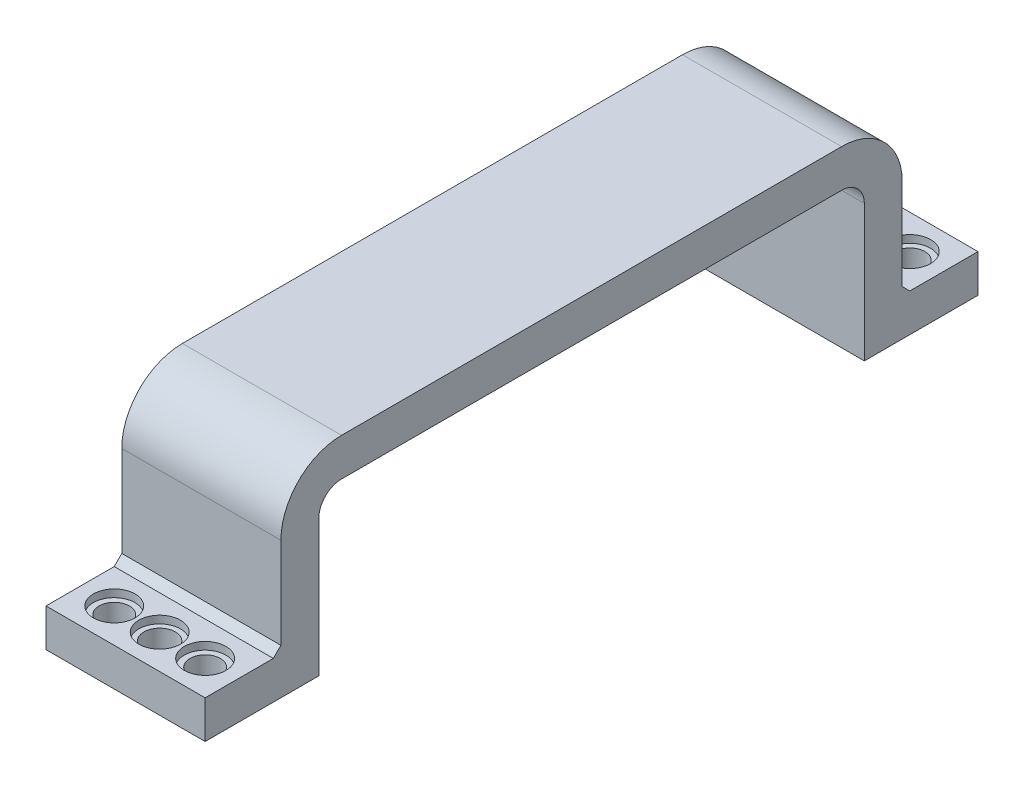
from build123d import *

# Parameters (mm, degrees)
SALIENTE_EXTRUIR1_DEPTH = 21
CROQUIS2_R              = 2.75
CORTAR_EXTRUIR1_DEPTH   = 22
CROQUIS3_R              = 2
CROQUIS3_R_2            = 2.070321152
CROQUIS3_R_3            = 1.933403805
CORTAR_EXTRUIR3_DEPTH   = 22
CROQUIS5_R              = 1.933403805
CROQUIS5_R_2            = 2.015312249
CORTAR_EXTRUIR4_DEPTH   = 22


with BuildPart() as part:
    # Croquis1 → Saliente-Extruir1 (new body)
    with BuildSketch(Plane(origin=(0, 0, 0), x_dir=(0, 0, -1), z_dir=(1, 0, 0))):
        with BuildLine():
            Line((-51, 0), (-36, 0))
            Line((-36, 0), (-36, 18))
            ThreePointArc((-36, 18), (-35.121320344, 20.121320344), (-33, 21))
            Line((-33, 21), (33, 21))
            ThreePointArc((33, 21), (35.121320344, 20.121320344), (36, 18))
            Line((36, 18), (36, 0))
            Line((36, 0), (51, 0))
            Line((51, 0), (51, 5))
            Line((51, 5), (42, 5))
            Line((42, 5), (41, 6))
            Line((41, 6), (41, 18))
            ThreePointArc((41, 18), (38.656854249, 23.656854249), (33, 26))
            Line((33, 26), (-33, 26))
            ThreePointArc((-33, 26), (-38.656854249, 23.656854249), (-41, 18))
            Line((-41, 18), (-41, 6))
            Line((-41, 6), (-42, 5))
            Line((-42, 5), (-51, 5))
            Line((-51, 5), (-51, 0))
        make_face()
    extrude(amount=SALIENTE_EXTRUIR1_DEPTH)

    # Croquis2 → Cortar-Extruir1 (cut)
    with BuildSketch(Plane(origin=(0, 26, 0), x_dir=(1, 0, 0), z_dir=(0, 1, 0))):
        with Locations(Location((10.5, 46.5, 0), (0, 0, 270))):
            Circle(CROQUIS2_R)
        with Locations(Location((16.5, 46.5, 0), (0, 0, 270))):
            Circle(CROQUIS2_R)
        with Locations(Location((4.5, 46.5, 0), (0, 0, 270))):
            Circle(CROQUIS2_R)
        with Locations(Location((16.5, -46.5, 0), (0, 0, 90))):
            Circle(CROQUIS2_R)
        with Locations(Location((10.5, -46.5, 0), (0, 0, 90))):
            Circle(CROQUIS2_R)
        with Locations(Location((4.5, -46.5, 0), (0, 0, 90))):
            Circle(CROQUIS2_R)
    extrude(amount=-CORTAR_EXTRUIR1_DEPTH, mode=Mode.SUBTRACT)

    # Croquis3 → Cortar-Extruir3 (cut)
    # profile 1 of 6: a face of its own
    with BuildSketch(Plane(origin=(0, 4, 0), x_dir=(1, 0, 0), z_dir=(0, 1, 0))):
        with Locations(Location((4.5, 46.5, 0), (0, 0, 270))):
            Circle(CROQUIS3_R)
    # profile 2 of 6: a face of its own
    with BuildSketch(Plane(origin=(0, 4, 0), x_dir=(1, 0, 0), z_dir=(0, 1, 0))):
        with Locations(Location((10.5, 46.5, 0), (0, 0, 270))):
            Circle(CROQUIS3_R)
    # profile 3 of 6: a face of its own
    with BuildSketch(Plane(origin=(0, 4, 0), x_dir=(1, 0, 0), z_dir=(0, 1, 0))):
        with Locations(Location((16.5, 46.5, 0), (0, 0, 270))):
            Circle(CROQUIS3_R)
    # profile 4 of 6: a face of its own
    with BuildSketch(Plane(origin=(0, 4, 0), x_dir=(1, 0, 0), z_dir=(0, 1, 0))):
        with Locations(Location((10.5, -46.5, 0), (0, 0, 270))):
            Circle(CROQUIS3_R_2)
        with Locations(Location((10.5, -46.5, 0), (0, 0, 270))):
            Circle(CROQUIS3_R, mode=Mode.SUBTRACT)
    # profile 5 of 6: a face of its own
    with BuildSketch(Plane(origin=(0, 4, 0), x_dir=(1, 0, 0), z_dir=(0, 1, 0))):
        with Locations(Location((16.5, -46.5, 0), (0, 0, 270))):
            Circle(CROQUIS3_R)
        with Locations(Location((16.5, -46.5, 0), (0, 0, 270))):
            Circle(CROQUIS3_R_3, mode=Mode.SUBTRACT)
    # profile 6 of 6: a face of its own
    with BuildSketch(Plane(origin=(0, 4, 0), x_dir=(1, 0, 0), z_dir=(0, 1, 0))):
        with Locations(Location((4.5, -46.5, 0), (0, 0, 270))):
            Circle(CROQUIS3_R)
        with Locations(Location((4.5, -46.5, 0), (0, 0, 270))):
            Circle(CROQUIS3_R_3, mode=Mode.SUBTRACT)
    extrude(amount=-CORTAR_EXTRUIR3_DEPTH, mode=Mode.SUBTRACT)


with BuildPart() as cortar_extruir3_piece_1:
    # of the separate pieces the step leaves, piece 1, a body of its own (cortar_extruir3_pieces)
    add(part.part.solids().sort_by_distance((0, 18, 41))[0])


with BuildPart() as cortar_extruir3_piece_2:
    # of the separate pieces the step leaves, piece 2, a body of its own (cortar_extruir3_pieces)
    add(part.part.solids().sort_by_distance((10.5, 0, 48.5))[0])


with BuildPart() as cortar_extruir3_piece_3:
    # of the separate pieces the step leaves, piece 3, a body of its own (cortar_extruir3_pieces)
    add(part.part.solids().sort_by_distance((4.5, 0, 48.433403805))[0])


with BuildPart() as cortar_extruir3_piece_4:
    # of the separate pieces the step leaves, piece 4, a body of its own (cortar_extruir3_pieces)
    add(part.part.solids().sort_by_distance((16.5, 0, 48.433403805))[0])


with BuildPart() as cortar_extruir4_tool:
    # Croquis5 → Cortar-Extruir4 (new body)
    with BuildSketch(Plane(origin=(0, 4, 0), x_dir=(1, 0, 0), z_dir=(0, 1, 0))):
        with Locations((4.5, -46.5)):
            Circle(CROQUIS5_R)
        with Locations((10.5, -46.5)):
            Circle(CROQUIS5_R_2)
        with Locations((16.5, -46.5)):
            Circle(CROQUIS5_R)
    extrude(amount=-CORTAR_EXTRUIR4_DEPTH)


with BuildPart() as cortar_extruir3_piece_2_1:
    add(cortar_extruir3_piece_2.part)

    # Cortar-Extruir4: cut by cortar_extruir4_tool
    add(cortar_extruir4_tool.part, mode=Mode.SUBTRACT)


with BuildPart() as cortar_extruir3_piece_3_1:
    add(cortar_extruir3_piece_3.part)

    # Cortar-Extruir4: cut by cortar_extruir4_tool
    add(cortar_extruir4_tool.part, mode=Mode.SUBTRACT)


with BuildPart() as cortar_extruir3_piece_4_1:
    add(cortar_extruir3_piece_4.part)

    # Cortar-Extruir4: cut by cortar_extruir4_tool
    add(cortar_extruir4_tool.part, mode=Mode.SUBTRACT)


solid = cortar_extruir3_piece_1.part
